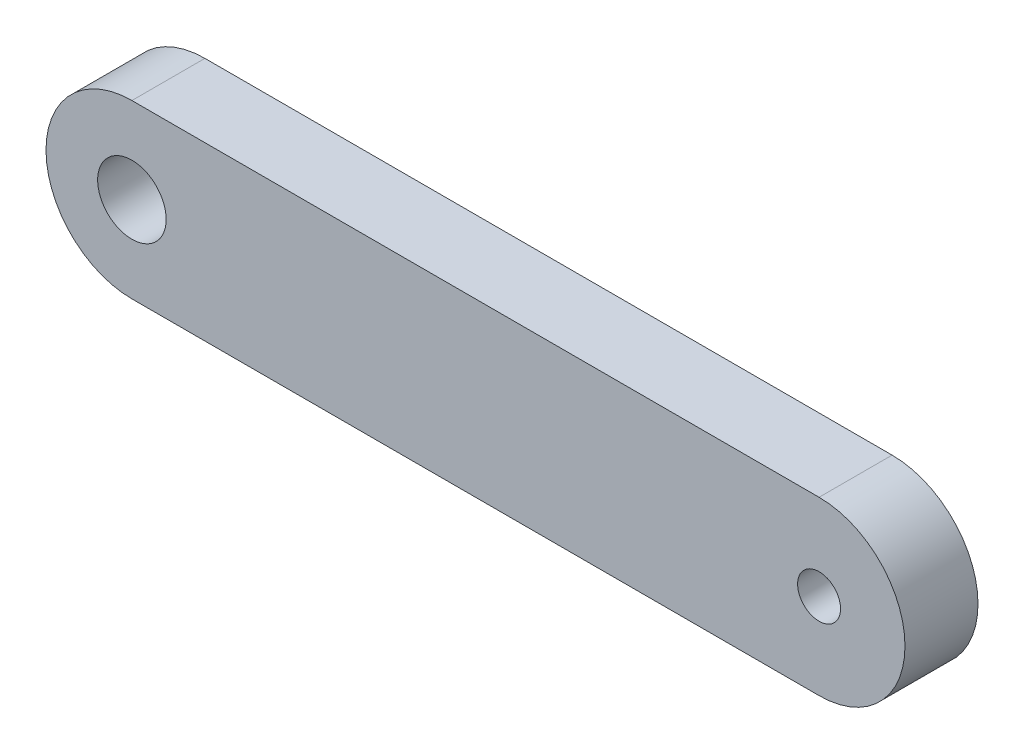
from build123d import *

# Parameters (mm, degrees)
SKETCH_1_R               = 2.5
EXTRUDE_1_DEPTH          = 8.5
CUT_EXTRUDE_2_DEPTH      = 91.95191037
CUT_EXTRUDE_2_DEPTH_BACK = 91.95191037
SKETCH_2_R               = 3.98703102


with BuildPart() as part:
    # 草图1 → 凸台-拉伸1 (new body)
    with BuildSketch(Plane.XY):
        with BuildLine():
            Line((0, 10), (80, 10))
            ThreePointArc((80, 10), (90, 0), (80, -10))
            Line((80, -10), (0, -10))
            ThreePointArc((0, -10), (-10, 0), (0, 10))
        make_face()
        Circle(SKETCH_1_R, mode=Mode.SUBTRACT)
        with Locations(Location((80, 0, 0), (0, 0, 180))):
            Circle(SKETCH_1_R, mode=Mode.SUBTRACT)
    extrude(amount=EXTRUDE_1_DEPTH)

    # 草图2 → 切除-拉伸2 (cut, two sides: drawn at the far end of the back side and taken through both)
    with BuildSketch(Plane.XY.offset(8.5).offset(-CUT_EXTRUDE_2_DEPTH_BACK)):
        Circle(SKETCH_2_R)
    extrude(amount=CUT_EXTRUDE_2_DEPTH + CUT_EXTRUDE_2_DEPTH_BACK, mode=Mode.SUBTRACT)


solid = part.part
